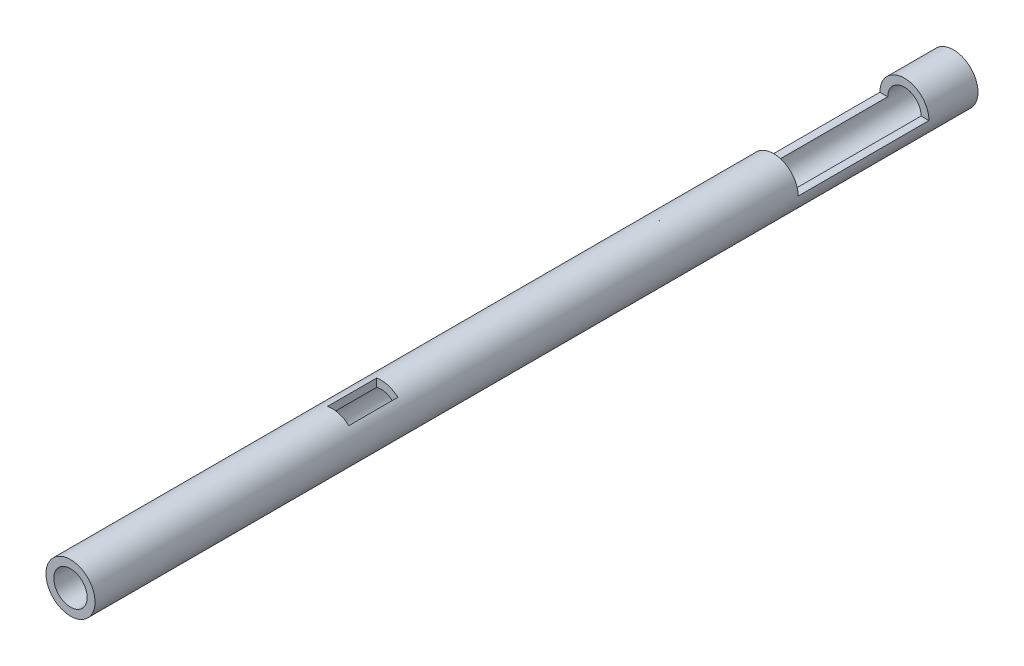
from build123d import *

# Parameters (mm, degrees)
SKETCH2_R               = 19.05
SKETCH2_R_2             = 12.954
BOSS_EXTRUDE1_DEPTH     = 685.8
CUT_EXTRUDE1_REACH      = 688.329
SKETCH3_W               = 50.8
SKETCH3_H               = 101.6
CUT_EXTRUDE2_REACH      = 688.329
CUT_EXTRUDE2_END_RADIUS = 19.05
SKETCH4_W               = 16.51
SKETCH4_H               = 38.1


with BuildPart() as part:
    # Sketch2 → Boss-Extrude1 (new body)
    with BuildSketch(Plane.XY):
        Circle(SKETCH2_R)
        Circle(SKETCH2_R_2, mode=Mode.SUBTRACT)
    extrude(amount=BOSS_EXTRUDE1_DEPTH)

    # Sketch3 → Cut-Extrude1 (cut, up to next)
    with BuildSketch(Plane(origin=(0, 0, 0), x_dir=(1, 0, 0), z_dir=(0, 1, 0)), mode=Mode.PRIVATE) as cut_extrude1_sk1:
        with Locations((0, -88.9)):
            Rectangle(SKETCH3_W, SKETCH3_H)
    cut_extrude1_tool1 = extrude(cut_extrude1_sk1.sketch, amount=CUT_EXTRUDE1_REACH, mode=Mode.PRIVATE) & part.part
    add(cut_extrude1_tool1.solids().sort_by_distance((0, 0, 88.9))[0], mode=Mode.SUBTRACT)

    # Cut-Extrude2: up to this cylinder (the profile starts inside it)
    cut_extrude2_end = Plane(origin=(0, 0, 463.55), z_dir=(0, 0, -1)) * Cylinder(CUT_EXTRUDE2_END_RADIUS, 1415.758, mode=Mode.PRIVATE)
    # Sketch4 → Cut-Extrude2 (cut, up to the surface)
    with BuildSketch(Plane(origin=(0, 0, 0), x_dir=(1, 0, 0), z_dir=(0, 1, 0)), mode=Mode.PRIVATE) as cut_extrude2_sk1:
        with Locations((4.699, -463.55)):
            Rectangle(SKETCH4_W, SKETCH4_H)
    cut_extrude2_tool1 = extrude(cut_extrude2_sk1.sketch, amount=CUT_EXTRUDE2_REACH, mode=Mode.PRIVATE) & cut_extrude2_end
    add(cut_extrude2_tool1.solids().sort_by_distance((4.699, 0, 463.55))[0], mode=Mode.SUBTRACT)


solid = part.part
